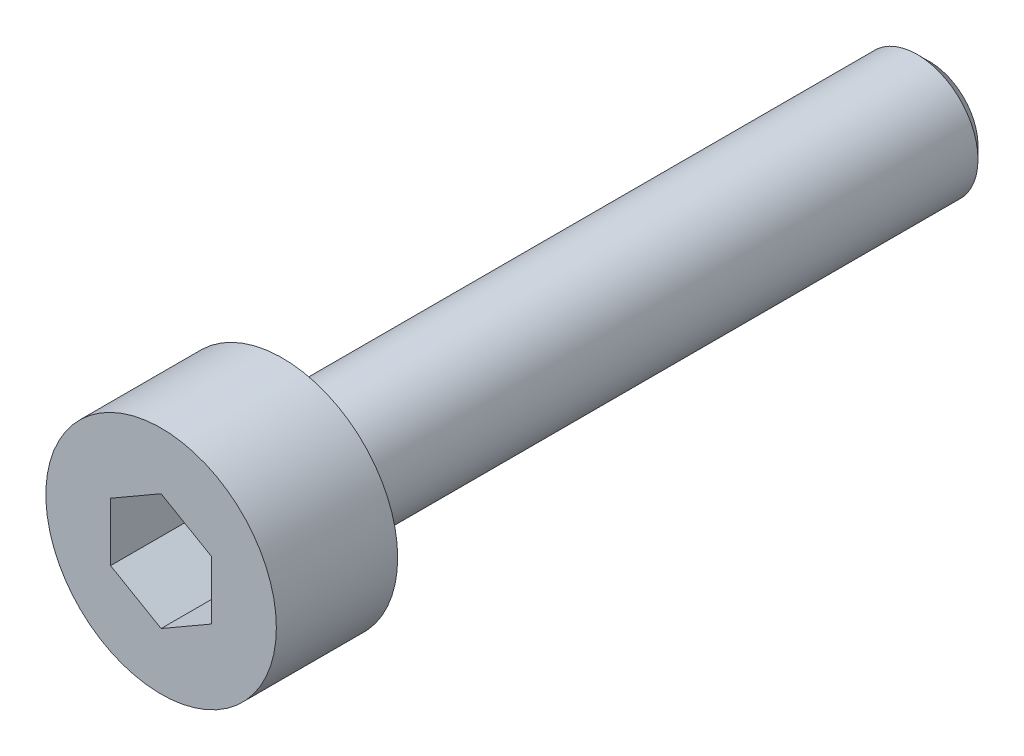
from build123d import *

# Parameters (mm, degrees)
SKETCH1_R           = 2.85
BOSS_EXTRUDE1_DEPTH = 3
SKETCH2_R           = 1.5
BOSS_EXTRUDE2_DEPTH = 16
CHAMFER1_SIZE       = 0.3
CUT_EXTRUDE1_DEPTH  = 2


with BuildPart() as part:
    # Sketch1 → Boss-Extrude1 (new body)
    with BuildSketch(Plane.XY):
        Circle(SKETCH1_R)
    extrude(amount=BOSS_EXTRUDE1_DEPTH)

    # Sketch2 → Boss-Extrude2 (add)
    with BuildSketch(Plane(origin=(0, 0, 0), x_dir=(-1, 0, 0), z_dir=(0, 0, -1))):
        with Locations(Location((0, 0, 0), (0, 0, 180))):
            Circle(SKETCH2_R)
    extrude(amount=BOSS_EXTRUDE2_DEPTH)

    # Chamfer1
    chamfer1_edges = [part.edges().sort_by_distance(p)[0] for p in [
        (-1.5, 0, -16),
    ]]
    chamfer(chamfer1_edges, length=CHAMFER1_SIZE)

    # Sketch3 → Cut-Extrude1 (cut)
    with BuildSketch(Plane.XY.offset(3)):
        Polygon((0, 1.443375673), (-1.25, 0.721687836), (-1.25, -0.721687836), (0, -1.443375673), (1.25, -0.721687836), (1.25, 0.721687836), align=None)
    extrude(amount=-CUT_EXTRUDE1_DEPTH, mode=Mode.SUBTRACT)


solid = part.part
